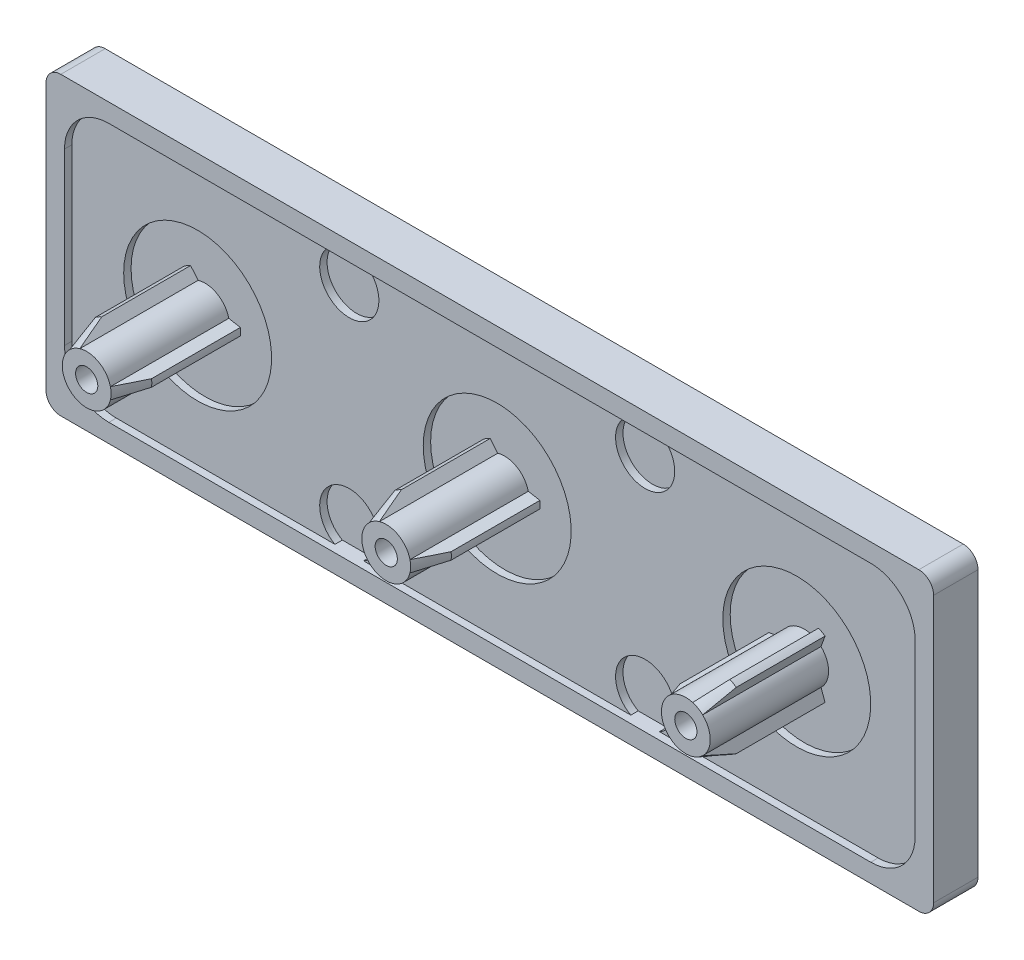
from build123d import *

# Parameters (mm, degrees)
BOSS_EXTRUDE1_DEPTH = 3
CUT_EXTRUDE1_DEPTH  = 0.5
SKETCH3_W           = 5
SKETCH3_H           = 0.5
SKETCH4_W           = 5
SKETCH4_H           = 0.5
SKETCH5_W           = 5
SKETCH5_H           = 0.5
CUT_EXTRUDE2_DEPTH  = 0.5
CUT_EXTRUDE3_DEPTH  = 0.5
CUT_EXTRUDE4_DEPTH  = 0.5
CUT_EXTRUDE5_DEPTH  = 0.5
BOSS_EXTRUDE2_DEPTH = 8
BOSS_EXTRUDE3_DEPTH = 8
BOSS_EXTRUDE4_DEPTH = 8
SKETCH16_W          = 0.75
SKETCH16_H          = 8
SKETCH17_W          = 0.75
SKETCH17_H          = 8
SKETCH18_W          = 0.75
SKETCH18_H          = 8


with BuildPart() as part:
    # Sketch1 → Boss-Extrude1 (new body)
    with BuildSketch(Plane.XY):
        with BuildLine():
            Line((-29, -10), (29, -10))
            ThreePointArc((29, -10), (29.707106781, -9.707106781), (30, -9))
            Line((30, -9), (30, 9))
            ThreePointArc((30, 9), (29.707106781, 9.707106781), (29, 10))
            Line((29, 10), (-29, 10))
            ThreePointArc((-29, 10), (-29.707106781, 9.707106781), (-30, 9))
            Line((-30, 9), (-30, -9))
            ThreePointArc((-30, -9), (-29.707106781, -9.707106781), (-29, -10))
        make_face()
    extrude(amount=-BOSS_EXTRUDE1_DEPTH)

    # Sketch2 → Cut-Extrude1 (cut)
    with BuildSketch(Plane.XY):
        with BuildLine():
            Line((-25.75, -8.75), (25.75, -8.75))
            ThreePointArc((25.75, -8.75), (27.871320344, -7.871320344), (28.75, -5.75))
            Line((28.75, -5.75), (28.75, 5.75))
            ThreePointArc((28.75, 5.75), (27.871320344, 7.871320344), (25.75, 8.75))
            Line((25.75, 8.75), (-25.75, 8.75))
            ThreePointArc((-25.75, 8.75), (-27.871320344, 7.871320344), (-28.75, 5.75))
            Line((-28.75, 5.75), (-28.75, -5.75))
            ThreePointArc((-28.75, -5.75), (-27.871320344, -7.871320344), (-25.75, -8.75))
        make_face()
    extrude(amount=-CUT_EXTRUDE1_DEPTH, mode=Mode.SUBTRACT)

    # Sketch3 → Cut-Revolve1 (revolve, cut)
    with BuildSketch(Plane(origin=(0, 0, 0), x_dir=(1, 0, 0), z_dir=(0, 1, 0)), mode=Mode.PRIVATE) as cut_revolve1_sk:
        with Locations((-17.75, 0.75)):
            Rectangle(SKETCH3_W, SKETCH3_H)
    revolve(cut_revolve1_sk.sketch.rotate(Axis((-20.25, 0, -0.5), (0, 0, -1)), 180), axis=Axis((-20.25, 0, -0.5), (0, 0, -1)), mode=Mode.SUBTRACT)

    # Sketch4 → Cut-Revolve2 (revolve, cut)
    with BuildSketch(Plane(origin=(0, 0, 0), x_dir=(1, 0, 0), z_dir=(0, 1, 0)), mode=Mode.PRIVATE) as cut_revolve2_sk:
        with Locations((2.5, 0.75)):
            Rectangle(SKETCH4_W, SKETCH4_H)
    revolve(cut_revolve2_sk.sketch.rotate(Axis((0, 0, -0.5), (0, 0, -1)), 180), axis=Axis((0, 0, -0.5), (0, 0, -1)), mode=Mode.SUBTRACT)

    # Sketch5 → Cut-Revolve3 (revolve, cut)
    with BuildSketch(Plane(origin=(0, 0, 0), x_dir=(1, 0, 0), z_dir=(0, 1, 0)), mode=Mode.PRIVATE) as cut_revolve3_sk:
        with Locations((22.75, 0.75)):
            Rectangle(SKETCH5_W, SKETCH5_H)
    revolve(cut_revolve3_sk.sketch.rotate(Axis((20.25, 0, -0.5), (0, 0, -1)), 180), axis=Axis((20.25, 0, -0.5), (0, 0, -1)), mode=Mode.SUBTRACT)

    # Sketch6 → Cut-Extrude2 (cut)
    with BuildSketch(Plane.XY.offset(-0.5)):
        with BuildLine():
            Line((-9.031754163, 8.75), (-10.968245837, 8.75))
            ThreePointArc((-10.968245837, 8.75), (-10, 5), (-9.031754163, 8.75))
        make_face()
    extrude(amount=-CUT_EXTRUDE2_DEPTH, mode=Mode.SUBTRACT)

    # Sketch7 → Cut-Extrude3 (cut)
    with BuildSketch(Plane.XY.offset(-0.5)):
        with BuildLine():
            Line((10.968245837, 8.75), (9.031754163, 8.75))
            ThreePointArc((9.031754163, 8.75), (10, 5), (10.968245837, 8.75))
        make_face()
    extrude(amount=-CUT_EXTRUDE3_DEPTH, mode=Mode.SUBTRACT)

    # Sketch8 → Cut-Extrude4 (cut)
    with BuildSketch(Plane.XY.offset(-0.5)):
        with BuildLine():
            Line((-10.968245837, -8.75), (-9.031754163, -8.75))
            ThreePointArc((-9.031754163, -8.75), (-10, -5), (-10.968245837, -8.75))
        make_face()
    extrude(amount=-CUT_EXTRUDE4_DEPTH, mode=Mode.SUBTRACT)

    # Sketch9 → Cut-Extrude5 (cut)
    with BuildSketch(Plane.XY.offset(-0.5)):
        with BuildLine():
            Line((9.031754163, -8.75), (10.968245837, -8.75))
            ThreePointArc((10.968245837, -8.75), (10, -5), (9.031754163, -8.75))
        make_face()
    extrude(amount=-CUT_EXTRUDE5_DEPTH, mode=Mode.SUBTRACT)

    # Sketch10 → Boss-Extrude2 (add)
    with BuildSketch(Plane.XY.offset(-1)):
        with BuildLine():
            Line((-1.13937326, -1.193452376), (-1.409978177, -1.94215384))
            ThreePointArc((-1.409978177, -1.94215384), (-1.2, -2.078460969), (-0.976965475, -2.19215384))
            Line((-0.976965475, -2.19215384), (-0.463873445, -1.583452376))
            ThreePointArc((-0.463873445, -1.583452376), (0.825, -1.428941916), (1.603246706, -0.39))
            Line((1.603246706, -0.39), (2.386943652, -0.25))
            ThreePointArc((2.386943652, -0.25), (2.4, 0), (2.386943652, 0.25))
            Line((2.386943652, 0.25), (1.603246706, 0.39))
            ThreePointArc((1.603246706, 0.39), (0.825, 1.428941916), (-0.463873445, 1.583452376))
            Line((-0.463873445, 1.583452376), (-0.976965475, 2.19215384))
            ThreePointArc((-0.976965475, 2.19215384), (-1.2, 2.078460969), (-1.409978177, 1.94215384))
            Line((-1.409978177, 1.94215384), (-1.13937326, 1.193452376))
            ThreePointArc((-1.13937326, 1.193452376), (-1.65, 0), (-1.13937326, -1.193452376))
        make_face()
    extrude(amount=BOSS_EXTRUDE2_DEPTH)

    # Sketch11 → Boss-Extrude3 (add)
    with BuildSketch(Plane.XY.offset(-1)):
        with BuildLine():
            Line((-21.38937326, -1.193452376), (-21.659978177, -1.94215384))
            ThreePointArc((-21.659978177, -1.94215384), (-21.45, -2.078460969), (-21.226965475, -2.19215384))
            Line((-21.226965475, -2.19215384), (-20.713873445, -1.583452376))
            ThreePointArc((-20.713873445, -1.583452376), (-19.425, -1.428941916), (-18.646753294, -0.39))
            Line((-18.646753294, -0.39), (-17.863056348, -0.25))
            ThreePointArc((-17.863056348, -0.25), (-17.85, 0), (-17.863056348, 0.25))
            Line((-17.863056348, 0.25), (-18.646753294, 0.39))
            ThreePointArc((-18.646753294, 0.39), (-19.425, 1.428941916), (-20.713873445, 1.583452376))
            Line((-20.713873445, 1.583452376), (-21.226965475, 2.19215384))
            ThreePointArc((-21.226965475, 2.19215384), (-21.45, 2.078460969), (-21.659978177, 1.94215384))
            Line((-21.659978177, 1.94215384), (-21.38937326, 1.193452376))
            ThreePointArc((-21.38937326, 1.193452376), (-21.9, 0), (-21.38937326, -1.193452376))
        make_face()
    extrude(amount=BOSS_EXTRUDE3_DEPTH)

    # Sketch12 → Boss-Extrude4 (add)
    with BuildSketch(Plane.XY.offset(-1)):
        with BuildLine():
            Line((17.863056348, -0.25), (18.646753294, -0.39))
            ThreePointArc((18.646753294, -0.39), (19.425, -1.428941916), (20.713873445, -1.583452376))
            Line((20.713873445, -1.583452376), (21.226965475, -2.19215384))
            ThreePointArc((21.226965475, -2.19215384), (21.45, -2.078460969), (21.659978177, -1.94215384))
            Line((21.659978177, -1.94215384), (21.38937326, -1.193452376))
            ThreePointArc((21.38937326, -1.193452376), (21.9, 0), (21.38937326, 1.193452376))
            Line((21.38937326, 1.193452376), (21.659978177, 1.94215384))
            ThreePointArc((21.659978177, 1.94215384), (21.45, 2.078460969), (21.226965475, 2.19215384))
            Line((21.226965475, 2.19215384), (20.713873445, 1.583452376))
            ThreePointArc((20.713873445, 1.583452376), (19.425, 1.428941916), (18.646753294, 0.39))
            Line((18.646753294, 0.39), (17.863056348, 0.25))
            ThreePointArc((17.863056348, 0.25), (17.85, 0), (17.863056348, -0.25))
        make_face()
    extrude(amount=BOSS_EXTRUDE4_DEPTH)

    # Sketch13 → Cut-Revolve4 (revolve, cut)
    with BuildSketch(Plane(origin=(0, 0, 0), x_dir=(1, 0, 0), z_dir=(0, 1, 0))):
        Polygon((-18.7125, -7.3), (-17.55, -7.3), (-17.55, -4.2), align=None)
    revolve(axis=Axis((-20.25, 0, 50), (0, 0, -1)), mode=Mode.SUBTRACT)

    # Sketch14 → Cut-Revolve5 (revolve, cut)
    with BuildSketch(Plane(origin=(0, 0, 0), x_dir=(1, 0, 0), z_dir=(0, 1, 0))):
        Polygon((1.5375, -7.3), (2.7, -7.3), (2.7, -4.2), align=None)
    revolve(axis=Axis((0, 0, 50), (0, 0, -1)), mode=Mode.SUBTRACT)

    # Sketch15 → Cut-Revolve6 (revolve, cut)
    with BuildSketch(Plane(origin=(0, 0, 0), x_dir=(1, 0, 0), z_dir=(0, 1, 0))):
        Polygon((21.7875, -7.3), (22.95, -7.3), (22.95, -4.2), align=None)
    revolve(axis=Axis((20.25, 0, 50), (0, 0, -1)), mode=Mode.SUBTRACT)

    # Sketch16 → Cut-Revolve7 (revolve, cut)
    with BuildSketch(Plane(origin=(0, 0, 0), x_dir=(1, 0, 0), z_dir=(0, 1, 0)), mode=Mode.PRIVATE) as cut_revolve7_sk:
        with Locations((-19.875, -3)):
            Rectangle(SKETCH16_W, SKETCH16_H)
    revolve(cut_revolve7_sk.sketch.rotate(Axis((-20.25, 0, 7), (0, 0, -1)), 180), axis=Axis((-20.25, 0, 7), (0, 0, -1)), mode=Mode.SUBTRACT)

    # Sketch17 → Cut-Revolve8 (revolve, cut)
    with BuildSketch(Plane(origin=(0, 0, 0), x_dir=(1, 0, 0), z_dir=(0, 1, 0)), mode=Mode.PRIVATE) as cut_revolve8_sk:
        with Locations((0.375, -3)):
            Rectangle(SKETCH17_W, SKETCH17_H)
    revolve(cut_revolve8_sk.sketch.rotate(Axis((0, 0, 7), (0, 0, -1)), 180), axis=Axis((0, 0, 7), (0, 0, -1)), mode=Mode.SUBTRACT)

    # Sketch18 → Cut-Revolve9 (revolve, cut)
    with BuildSketch(Plane(origin=(0, 0, 0), x_dir=(1, 0, 0), z_dir=(0, 1, 0)), mode=Mode.PRIVATE) as cut_revolve9_sk:
        with Locations((20.625, -3)):
            Rectangle(SKETCH18_W, SKETCH18_H)
    revolve(cut_revolve9_sk.sketch.rotate(Axis((20.25, 0, 7), (0, 0, -1)), 180), axis=Axis((20.25, 0, 7), (0, 0, -1)), mode=Mode.SUBTRACT)


solid = part.part
